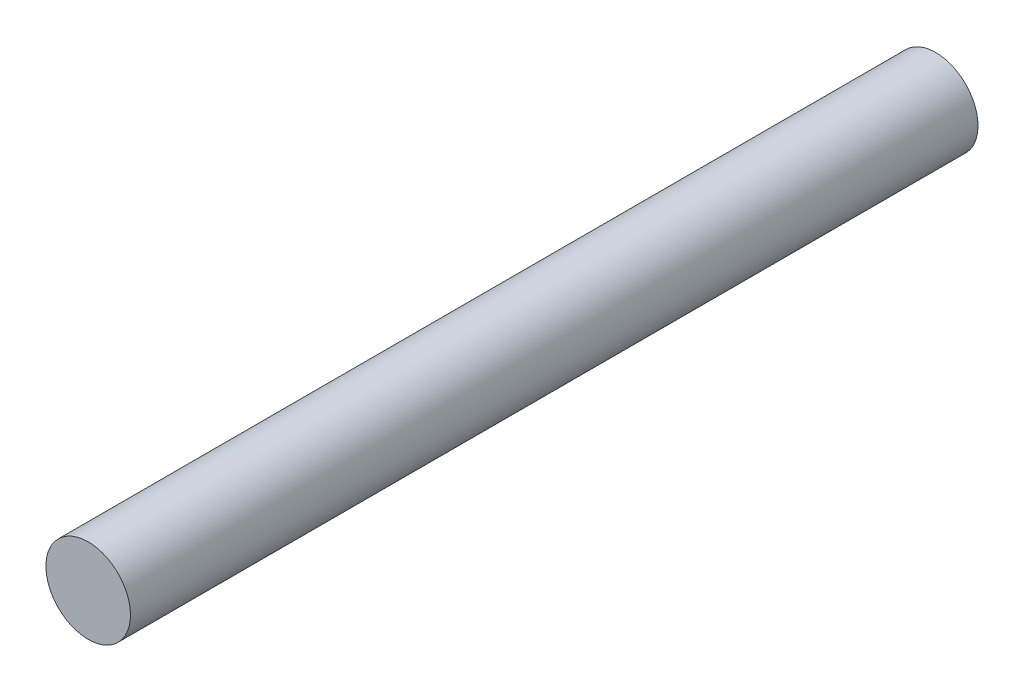
from build123d import *

# Parameters (mm, degrees)
SKETCH1_R           = 4.075
BOSS_EXTRUDE1_DEPTH = 81.7


with BuildPart() as part:
    # Sketch1 → Boss-Extrude1 (new body)
    with BuildSketch(Plane.XY):
        Circle(SKETCH1_R)
    extrude(amount=-BOSS_EXTRUDE1_DEPTH)


solid = part.part
